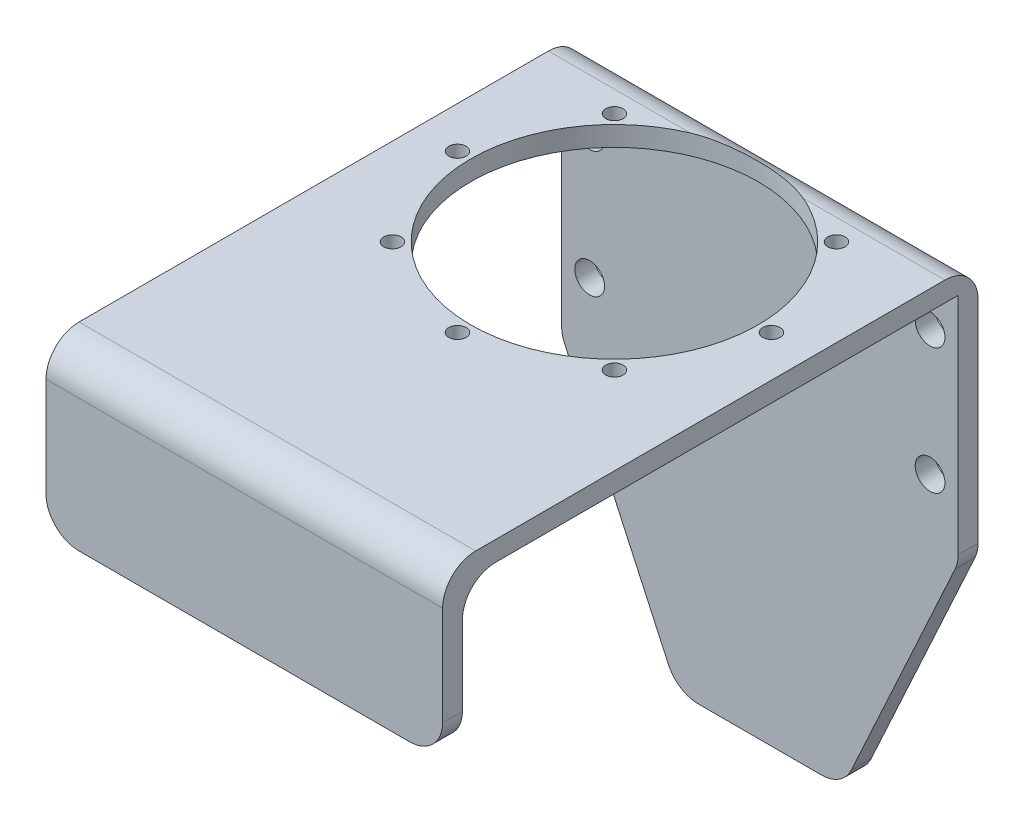
from build123d import *

# Parameters (mm, degrees)
CROQUIS1_R              = 4.5
SALIENTE_EXTRUIR1_DEPTH = 6
CROQUIS2_W              = 120
CROQUIS2_H              = 6
SALIENTE_EXTRUIR2_DEPTH = 156
CROQUIS3_W              = 120
CROQUIS3_H              = 44
SALIENTE_EXTRUIR3_DEPTH = 6
REDONDEO1_R             = 10
CROQUIS4_R              = 2.621
CORTAR_EXTRUIR1_DEPTH   = 237.980474234


with BuildPart() as part:
    # Croquis1 → Saliente-Extruir1 (new body)
    with BuildSketch(Plane.XY):
        Polygon((-92.102036721, -168.3), (-57.102036721, -244.5), (-7.102036721, -244.5), (27.897963279, -168.3), (27.897963279, -92.1), (-92.102036721, -92.1), align=None)
        with Locations((-83.602036721, -111.15)):
            Circle(CROQUIS1_R, mode=Mode.SUBTRACT)
        with Locations(Location((-83.602036721, -149.25, 0), (0, 0, 180))):
            Circle(CROQUIS1_R, mode=Mode.SUBTRACT)
        with Locations((19.397963279, -149.25)):
            Circle(CROQUIS1_R, mode=Mode.SUBTRACT)
        with Locations(Location((19.397963279, -111.15, 0), (0, 0, 180))):
            Circle(CROQUIS1_R, mode=Mode.SUBTRACT)
    extrude(amount=SALIENTE_EXTRUIR1_DEPTH)

    # Croquis2 → Saliente-Extruir2 (add)
    with BuildSketch(Plane.XY.offset(6)):
        with Locations((-32.102036721, -95.1)):
            Rectangle(CROQUIS2_W, CROQUIS2_H)
    extrude(amount=SALIENTE_EXTRUIR2_DEPTH)

    # Croquis3 → Saliente-Extruir3 (add)
    with BuildSketch(Plane.XY.offset(162)):
        with Locations((-32.102036721, -120.1)):
            Rectangle(CROQUIS3_W, CROQUIS3_H)
    extrude(amount=-SALIENTE_EXTRUIR3_DEPTH)

    # Redondeo1
    redondeo1_edges = [part.edges().sort_by_distance(p)[0] for p in [
        (27.897963279, -168.3, 3),
        (-7.102036721, -244.5, 3),
        (-57.102036721, -244.5, 3),
        (-92.102036721, -168.3, 3),
        (-32.102036721, -92.1, 162),
        (-92.102036721, -142.1, 159),
        (-32.102036721, -98.1, 156),
        (27.897963279, -142.1, 159),
        (-32.102036721, -92.1, 0),
    ]]
    fillet(redondeo1_edges, radius=REDONDEO1_R)

    # Croquis4 → Cortar-Extruir1 (cut, through all)
    with BuildSketch(Plane.XZ.offset(98.1)):
        with Locations(Location((1.485535385, 83.587572106, 0), (0, 0, 270))):
            Circle(CROQUIS4_R)
        with Locations(Location((-65.689608828, 16.412427894, 0), (0, 0, 270))):
            Circle(CROQUIS4_R)
        with Locations(Location((15.397963279, 50, 0), (0, 0, 270))):
            Circle(CROQUIS4_R)
        with Locations(Location((1.485535385, 16.412427894, 0), (0, 0, 270))):
            Circle(CROQUIS4_R)
        with Locations(Location((-65.689608828, 83.587572106, 0), (0, 0, 270))):
            Circle(CROQUIS4_R)
        with Locations(Location((-32.102036721, 97.5, 0), (0, 0, 270))):
            Circle(CROQUIS4_R)
        with Locations(Location((-79.602036721, 50, 0), (0, 0, 270))):
            Circle(CROQUIS4_R)
        with BuildLine():
            add(Edge.make_bspline(
                [(-32.102036721, 6.5), (-30.775341976, 6.499993534), (-28.122039283, 6.620682339), (-24.096613371, 7.177840976), (-20.062551193, 8.127248902), (-16.009319538, 9.510205402), (-12.057431762, 11.308759473), (-8.231122582, 13.545008905), (-4.625202085, 16.175326085), (-1.288566333, 19.186782917), (1.722751008, 22.523306389), (4.353148795, 26.129382286), (6.589284057, 29.95555323), (8.387887512, 33.907608072), (9.770762576, 37.960684071), (10.720181934, 41.994878278), (11.277273839, 46.020137925), (11.45831212, 50.000176972), (11.277257351, 53.980039938), (10.720117639, 58.005467444), (9.770712855, 62.03948534), (8.387758304, 66.092717236), (6.589203689, 70.044604944), (4.352954406, 73.870914143), (1.722637185, 77.476834635), (-1.288819636, 80.813470389), (-4.62534311, 83.824787729), (-8.231419007, 86.455185516), (-12.057589951, 88.691320778), (-16.009644794, 90.489924234), (-20.062720792, 91.872799297), (-24.096914999, 92.822218655), (-28.122174647, 93.37931056), (-32.102213693, 93.560348842), (-36.082076659, 93.379294072), (-40.107504165, 92.82215436), (-44.141522061, 91.872749576), (-48.194753957, 90.489795025), (-52.146641666, 88.691240411), (-55.972950865, 86.454991127), (-59.578871356, 83.824673906), (-62.91550711, 80.813217085), (-65.92682445, 77.476693611), (-68.557222237, 73.870617714), (-70.7933575, 70.04444677), (-72.591960955, 66.092391928), (-73.974836018, 62.039315929), (-74.924255376, 58.005121722), (-75.481347281, 53.979862075), (-75.662385563, 49.999823028), (-75.481330794, 46.019960062), (-74.924191081, 41.994532556), (-73.974786297, 37.96051466), (-72.591831746, 33.907282764), (-70.793277132, 29.955395056), (-68.557027848, 26.129085856), (-65.926710628, 22.523165366), (-62.915253807, 19.186529609), (-59.578730331, 16.17521228), (-55.972654439, 13.544814452), (-52.146483477, 11.308679338), (-48.194428701, 9.51007534), (-44.141352462, 8.127202224), (-40.107202532, 7.177786011), (-36.081941291, 6.620713021), (-33.428642641, 6.500006466), (-32.102036721, 6.5)],
                knots=[0, 0, 0, 0, 0.014562552, 0.029124133, 0.044561437, 0.059996822, 0.076077508, 0.092156266, 0.108579119, 0.125000004, 0.141422857, 0.157843742, 0.173924427, 0.190003186, 0.20544049, 0.220875875, 0.235438912, 0.250000004, 0.264563041, 0.279124133, 0.294561437, 0.309996822, 0.326077508, 0.342156266, 0.358579119, 0.375000004, 0.391422857, 0.407843742, 0.423924427, 0.440003186, 0.45544049, 0.470875875, 0.485438912, 0.500000004, 0.514563041, 0.529124133, 0.544561437, 0.559996822, 0.576077508, 0.592156266, 0.608579119, 0.625000004, 0.641422857, 0.657843742, 0.673924427, 0.690003186, 0.70544049, 0.720875875, 0.735438912, 0.750000004, 0.764563041, 0.779124133, 0.794561437, 0.809996822, 0.826077508, 0.842156266, 0.858579119, 0.875000004, 0.891422857, 0.907843742, 0.923924427, 0.940003186, 0.95544049, 0.970875875, 0.985438423, 1, 1, 1, 1], degree=3))
        make_face()
    extrude(amount=-CORTAR_EXTRUIR1_DEPTH, mode=Mode.SUBTRACT)


solid = part.part
